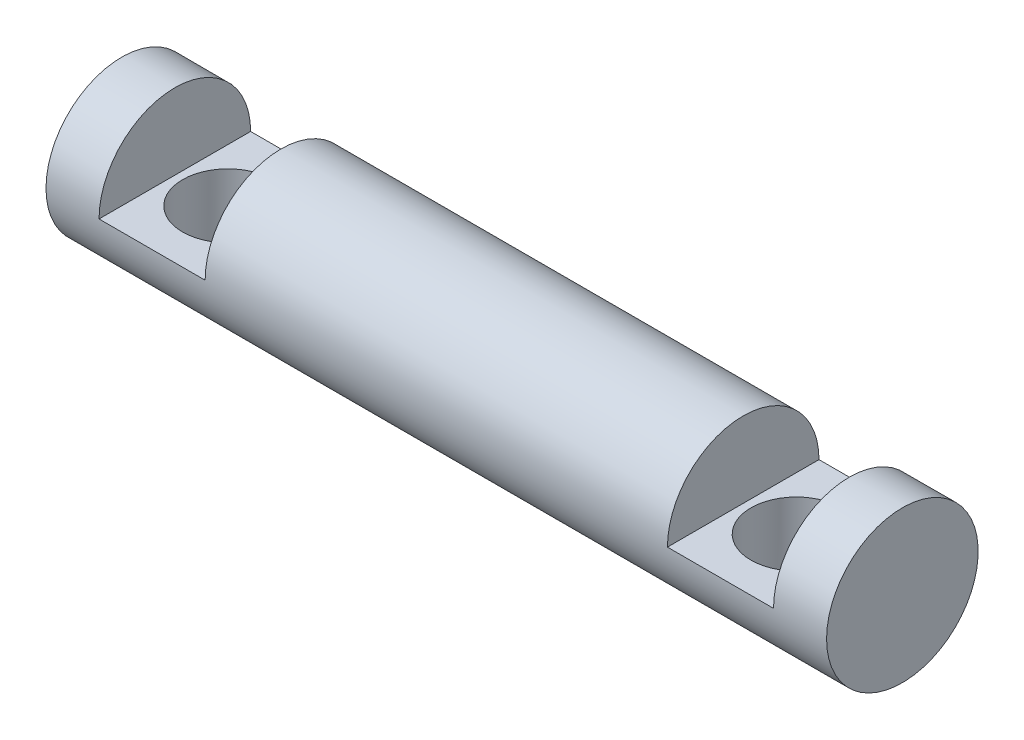
from build123d import *

# Parameters (mm, degrees)
SKETCH1_W               = 103
SKETCH1_H               = 10
CUT_EXTRUDE1_START      = -7
CUT_EXTRUDE1_DEPTH      = 14
CUT_EXTRUDE2_START      = -7
CUT_EXTRUDE2_DEPTH      = 14
CUT_EXTRUDE3_DEPTH      = 104.966340707
CUT_EXTRUDE3_DEPTH_BACK = 104.966340707
SKETCH4_R               = 5.983
SKETCH5_W               = 14
SKETCH5_H               = 25.426935298
CUT_EXTRUDE4_DEPTH      = 5


with BuildPart() as part:
    # Sketch1 → Revolve1 (revolve)
    with BuildSketch(Plane.XY, mode=Mode.PRIVATE) as revolve1_sk:
        with Locations((-51.5, 5)):
            Rectangle(SKETCH1_W, SKETCH1_H)
    revolve(revolve1_sk.sketch.rotate(Axis((-103, 0, 0), (1, 0, 0)), 90), axis=Axis((-103, 0, 0), (1, 0, 0)))

    # Sketch2 → Cut-Extrude1 (cut)
    with BuildSketch(Plane(origin=(0, 0, 0), x_dir=(0, 0, -1), z_dir=(1, 0, 0)).offset(CUT_EXTRUDE1_START)):
        with BuildLine():
            Line((-10.872335562, 5), (10.872335562, 5))
            ThreePointArc((10.872335562, 5), (0, 11.966941154), (-10.872335562, 5))
        make_face()
    extrude(amount=-CUT_EXTRUDE1_DEPTH, mode=Mode.SUBTRACT)

    # Sketch3 → Cut-Extrude2 (cut)
    with BuildSketch(Plane.ZY.offset(103).offset(CUT_EXTRUDE2_START)):
        with BuildLine():
            Line((-13.431588828, 5), (13.431588828, 5))
            ThreePointArc((13.431588828, 5), (0, 14.332047252), (-13.431588828, 5))
        make_face()
    extrude(amount=-CUT_EXTRUDE2_DEPTH, mode=Mode.SUBTRACT)

    # Sketch4 → Cut-Extrude3 (cut, two sides: drawn at the far end of the back side and taken through both)
    with BuildSketch(Plane(origin=(0, 0, 0), x_dir=(1, 0, 0), z_dir=(0, 1, 0)).offset(-CUT_EXTRUDE3_DEPTH_BACK)):
        with Locations(Location((-89, 0, 0), (0, 0, 270))):
            Circle(SKETCH4_R)
        with Locations(Location((-14, 0, 0), (0, 0, 270))):
            Circle(SKETCH4_R)
    extrude(amount=CUT_EXTRUDE3_DEPTH + CUT_EXTRUDE3_DEPTH_BACK, mode=Mode.SUBTRACT)

    # Sketch5 → Cut-Extrude4 (cut)
    with BuildSketch(Plane(origin=(0, 5, 0), x_dir=(1, 0, 0), z_dir=(0, 1, 0))):
        with Locations((-89, 0)):
            Rectangle(SKETCH5_W, SKETCH5_H)
        with Locations((-14, 0)):
            Rectangle(SKETCH5_W, SKETCH5_H)
    extrude(amount=-CUT_EXTRUDE4_DEPTH, mode=Mode.SUBTRACT)


solid = part.part
